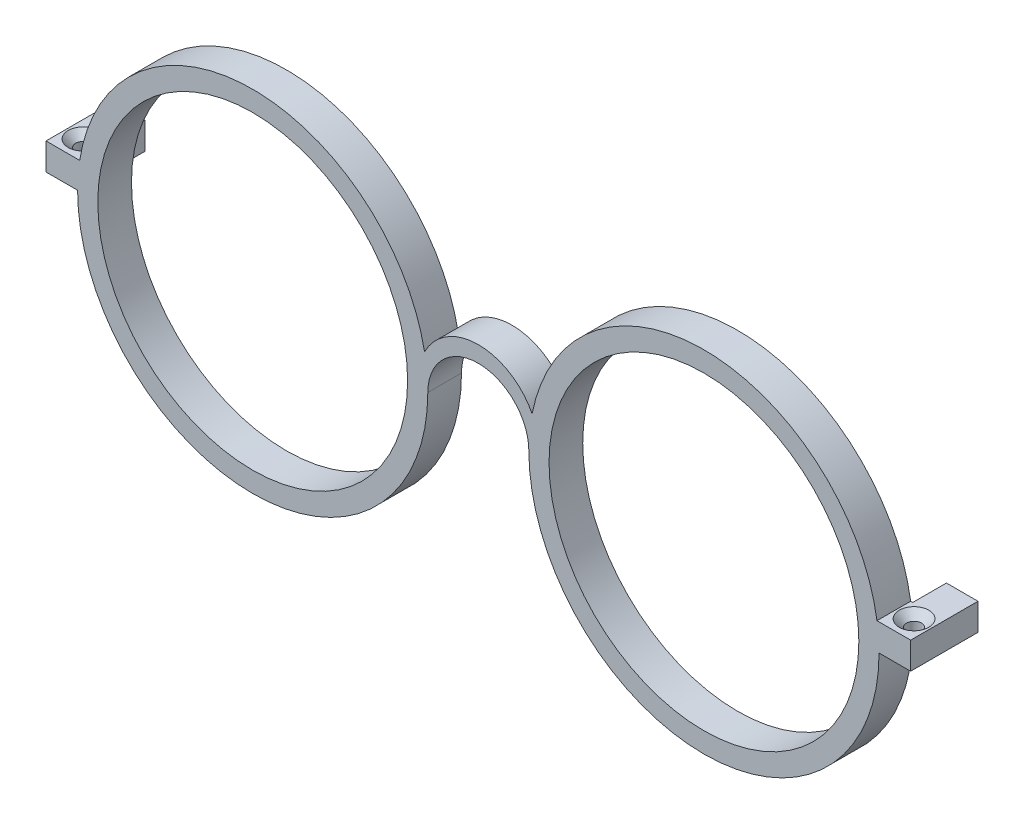
from build123d import *

# Parameters (mm, degrees)
SKIZZE1_R                                            = 23
AUFSATZ_LINEAR_AUSTRAGEN1_DEPTH                      = 5
SKIZZE2_W                                            = 4.690465157
SKIZZE2_H                                            = 4
AUFSATZ_LINEAR_AUSTRAGEN2_DEPTH                      = 5
FORMSENKUNG_F_R_M2_SENKSCHRAUBE_MIT_SCHL_D           = 2.2
FORMSENKUNG_F_R_M2_SENKSCHRAUBE_MIT_SCHL_DEPTH       = 50
FORMSENKUNG_F_R_M2_SENKSCHRAUBE_MIT_SCHL_CSINK_D     = 4.4
FORMSENKUNG_F_R_M2_SENKSCHRAUBE_MIT_SCHL_CSINK_ANGLE = 90
FORMSENKUNG_F_R_M2_SENKSCHRAUBE_MIT_SCHL_TIP         = 0.660946681


with BuildPart() as part:
    # Skizze1 → Aufsatz-Linear austragen1 (new body)
    with BuildSketch(Plane.XY):
        with BuildLine():
            Line((64.190465157, 4), (59.190465157, 4))
            ThreePointArc((59.190465157, 4), (34.007664459, 25.995043312), (7.985298356, 5))
            ThreePointArc((7.985298356, 5), (-0.004875067, 9.908732253), (-7.980769231, 4.976832421))
            ThreePointArc((-7.980769231, 4.976832421), (-33.995863589, 25.995271095), (-59.190465157, 4))
            Line((-59.190465157, 4), (-64.190465157, 4))
            Line((-64.190465157, 4), (-64.190465157, 0))
            Line((-64.190465157, 0), (-59.5, 0))
            ThreePointArc((-59.5, 0), (-33.5, -26), (-7.5, 0))
            ThreePointArc((-7.5, 0), (0, 7.5), (7.5, 0))
            ThreePointArc((7.5, 0), (33.5, -26), (59.5, 0))
            Line((59.5, 0), (64.190465157, 0))
            Line((64.190465157, 0), (64.190465157, 4))
        make_face()
        with Locations((33.5, 0)):
            Circle(SKIZZE1_R, mode=Mode.SUBTRACT)
        with Locations((-33.5, 0)):
            Circle(SKIZZE1_R, mode=Mode.SUBTRACT)
    extrude(amount=AUFSATZ_LINEAR_AUSTRAGEN1_DEPTH)

    # Skizze2 → Aufsatz-Linear austragen2 (add)
    with BuildSketch(Plane(origin=(0, 0, 0), x_dir=(-1, 0, 0), z_dir=(0, 0, -1))):
        with Locations((-61.845232579, 2)):
            Rectangle(SKIZZE2_W, SKIZZE2_H)
        with Locations((61.845232579, 2)):
            Rectangle(SKIZZE2_W, SKIZZE2_H)
    extrude(amount=AUFSATZ_LINEAR_AUSTRAGEN2_DEPTH)

    # Formsenkung für M2 Senkschraube mit Schlitz/Kreuzschlitz1
    with Locations(Plane(origin=(0, 4, 0), x_dir=(1, 0, 0), z_dir=(0, 1, 0))):
        with Locations((61.690465157, -2), (-61.690465157, -2)):
            CounterSinkHole(FORMSENKUNG_F_R_M2_SENKSCHRAUBE_MIT_SCHL_D / 2, FORMSENKUNG_F_R_M2_SENKSCHRAUBE_MIT_SCHL_CSINK_D / 2, depth=FORMSENKUNG_F_R_M2_SENKSCHRAUBE_MIT_SCHL_DEPTH, counter_sink_angle=FORMSENKUNG_F_R_M2_SENKSCHRAUBE_MIT_SCHL_CSINK_ANGLE)
            with Locations((0, 0, -(FORMSENKUNG_F_R_M2_SENKSCHRAUBE_MIT_SCHL_DEPTH + FORMSENKUNG_F_R_M2_SENKSCHRAUBE_MIT_SCHL_TIP / 2))):  # 118° drill point
                Cone(0, FORMSENKUNG_F_R_M2_SENKSCHRAUBE_MIT_SCHL_D / 2, FORMSENKUNG_F_R_M2_SENKSCHRAUBE_MIT_SCHL_TIP, mode=Mode.SUBTRACT)


solid = part.part
